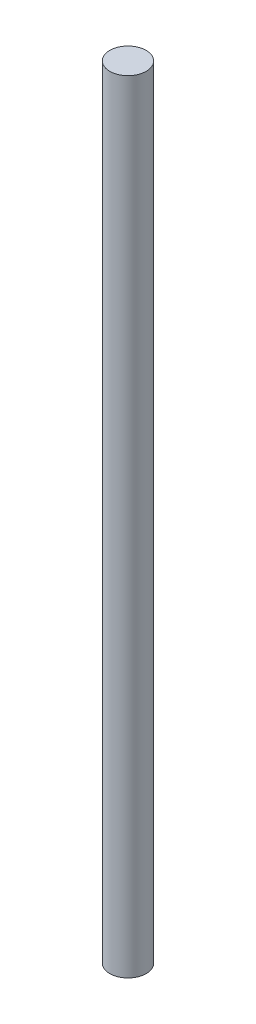
from build123d import *

# Parameters (mm, degrees)
SKETCH_1_R      = 1
EXTRUDE_1_DEPTH = 43


with BuildPart() as part:
    # 草图1 → 凸台-拉伸1 (new body)
    with BuildSketch(Plane(origin=(0, 0, 0), x_dir=(1, 0, 0), z_dir=(0, 1, 0))):
        with Locations(Location((0, 0, 0), (0, 0, 270))):
            Circle(SKETCH_1_R)
    extrude(amount=EXTRUDE_1_DEPTH)


solid = part.part
